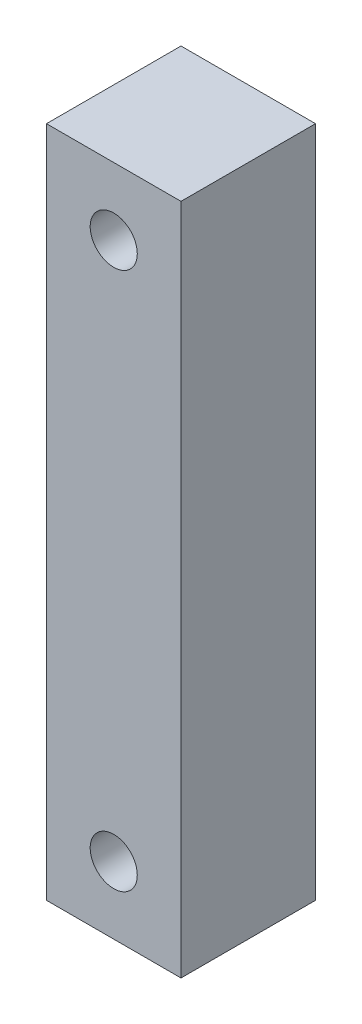
from build123d import *

# Parameters (mm, degrees)
SKETCH1_W           = 10
SKETCH1_H           = 10
BOSS_EXTRUDE1_DEPTH = 50
SKETCH2_R           = 1.75
CUT_EXTRUDE1_DEPTH  = 14


with BuildPart() as part:
    # Sketch1 → Boss-Extrude1 (new body)
    with BuildSketch(Plane(origin=(0, 0, 0), x_dir=(1, 0, 0), z_dir=(0, 1, 0))):
        Rectangle(SKETCH1_W, SKETCH1_H)
    extrude(amount=BOSS_EXTRUDE1_DEPTH)

    # Sketch2 → Cut-Extrude1 (cut)
    with BuildSketch(Plane.XY.offset(5)):
        with Locations((0, 5)):
            Circle(SKETCH2_R)
        with Locations((0, 45)):
            Circle(SKETCH2_R)
    extrude(amount=-CUT_EXTRUDE1_DEPTH, mode=Mode.SUBTRACT)


solid = part.part
